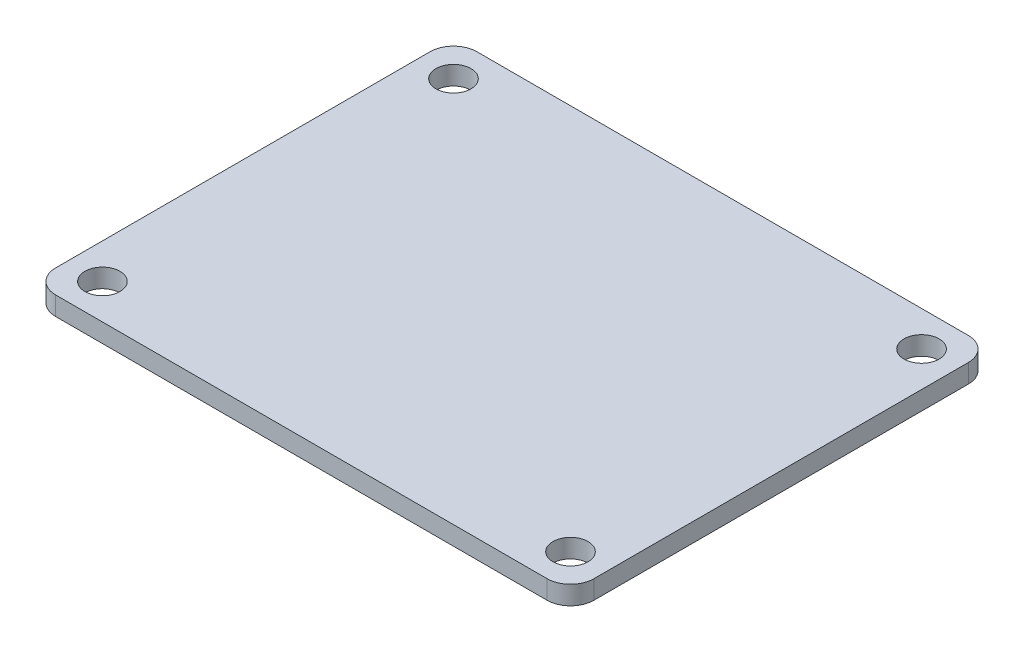
from build123d import *

# Parameters (mm, degrees)
SKETCH1_W           = 46
SKETCH1_H           = 36
SKETCH1_R           = 1.5
BOSS_EXTRUDE1_DEPTH = 1.6
FILLET1_R           = 2


with BuildPart() as part:
    # Sketch1 → Boss-Extrude1 (new body)
    with BuildSketch(Plane(origin=(0, 0, 0), x_dir=(1, 0, 0), z_dir=(0, 1, 0))):
        Rectangle(SKETCH1_W, SKETCH1_H)
        with Locations(Location((-20, 15, 0), (0, 0, 270))):
            Circle(SKETCH1_R, mode=Mode.SUBTRACT)
        with Locations(Location((20, 15, 0), (0, 0, 90))):
            Circle(SKETCH1_R, mode=Mode.SUBTRACT)
        with Locations(Location((-20, -15, 0), (0, 0, 90))):
            Circle(SKETCH1_R, mode=Mode.SUBTRACT)
        with Locations(Location((20, -15, 0), (0, 0, 270))):
            Circle(SKETCH1_R, mode=Mode.SUBTRACT)
    extrude(amount=BOSS_EXTRUDE1_DEPTH)

    # Fillet1
    fillet1_edges = [part.edges().sort_by_distance(p)[0] for p in [
        (23, 0.8, -18),
        (23, 0.8, 18),
        (-23, 0.8, 18),
        (-23, 0.8, -18),
    ]]
    fillet(fillet1_edges, radius=FILLET1_R)


solid = part.part
